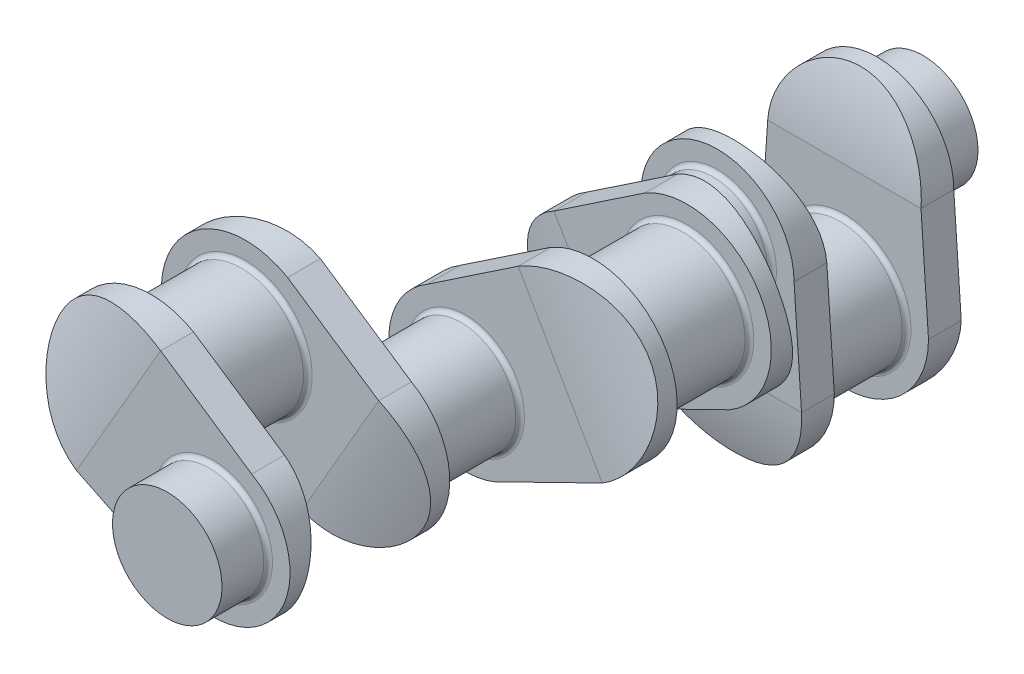
from build123d import *
from build123d.topology import SkipClean

# Parameters (mm, degrees)
SKETCH2_R             = 36.1
BOSS_EXTRUDE1_DEPTH   = 27.31
BOSS_EXTRUDE2_DEPTH   = 19
SKETCH4_R             = 31.75
BOSS_EXTRUDE3_DEPTH   = 26.76
CUT_EXTRUDE1_DEPTH    = 140.190040592
CUT_EXTRUDE7_DEPTH    = 140.190040627
FILLET6_R             = 2.54
FILLET6_OF_MIRROR1_R  = 2.54
LPATTERN13_COUNT      = 3
LPATTERN13_PITCH      = 146.14
BODY_MOVE_COPY1_ANGLE = 120
BODY_MOVE_COPY2_ANGLE = 120


with BuildPart() as part:
    # Sketch2 → Boss-Extrude1 (new body)
    with BuildSketch(Plane.XY):
        Circle(SKETCH2_R)
    boss_extrude1 = extrude(amount=BOSS_EXTRUDE1_DEPTH)

    # Sketch3 → Boss-Extrude2 (add)
    with BuildSketch(Plane.XY.offset(27.31)):
        with BuildLine():
            Line((-44.45, 63.5), (-48.8, 0))
            ThreePointArc((-48.8, 0), (0, -48.8), (48.8, 0))
            Line((48.8, 0), (44.45, 63.5))
            ThreePointArc((44.45, 63.5), (0, 107.95), (-44.45, 63.5))
        make_face()
    boss_extrude2 = extrude(amount=BOSS_EXTRUDE2_DEPTH)

    # Sketch4 → Boss-Extrude3 (add)
    with BuildSketch(Plane.XY.offset(46.31)):
        with Locations((0, 63.5)):
            Circle(SKETCH4_R)
    boss_extrude3 = extrude(amount=BOSS_EXTRUDE3_DEPTH)

    # Sketch5 → Cut-Extrude1 (cut, symmetric)
    with BuildSketch(Plane(origin=(0, 0, 0), x_dir=(0, 0, -1), z_dir=(1, 0, 0))):
        with BuildLine():
            Line((-46.31, 0), (-66.044239669, 0))
            Line((-66.044239669, 0), (-66.044239669, -48.8))
            Line((-66.044239669, -48.8), (-36.81, -48.8))
            ThreePointArc((-36.81, -48.8), (-43.36429868, -24.751246669), (-46.31, 0))
        make_face()
    cut_extrude1 = extrude(amount=CUT_EXTRUDE1_DEPTH, both=True, mode=Mode.SUBTRACT)

    # Sketch6 → Cut-Extrude7 (cut, symmetric)
    with BuildSketch(Plane(origin=(0, 0, 0), x_dir=(0, 0, -1), z_dir=(1, 0, 0))):
        with BuildLine():
            Line((-36.81, 107.95), (-15.735050366, 107.95))
            Line((-15.735050366, 107.95), (-15.735050366, 63.5))
            Line((-15.735050366, 63.5), (-27.31, 63.5))
            ThreePointArc((-27.31, 63.5), (-30.558785648, 86.045844462), (-36.81, 107.95))
        make_face()
    cut_extrude7 = extrude(amount=CUT_EXTRUDE7_DEPTH, both=True, mode=Mode.SUBTRACT)

    # Fillet6
    fillet6_edges = [part.edges().sort_by_distance(p)[0] for p in [
        (-31.75, 63.5, 46.31),
        (-36.1, 0, 27.31),
    ]]
    fillet(fillet6_edges, radius=FILLET6_R)

    # Mirror1: Boss-Extrude1, Boss-Extrude2, Boss-Extrude3, Cut-Extrude1, Cut-Extrude7 across plane
    add(boss_extrude1.mirror(Plane.XY))
    add(boss_extrude2.mirror(Plane.XY))
    add(boss_extrude3.mirror(Plane.XY))
    add(cut_extrude1.mirror(Plane.XY), mode=Mode.SUBTRACT)
    add(cut_extrude7.mirror(Plane.XY), mode=Mode.SUBTRACT)

    # Fillet6 of Mirror1
    fillet6_of_mirror1_edges = [part.edges().sort_by_distance(p)[0] for p in [
        (-31.75, 63.5, -46.31),
        (-36.1, 0, -27.31),
    ]]
    fillet(fillet6_of_mirror1_edges, radius=FILLET6_OF_MIRROR1_R)


with BuildPart() as lpattern13_1:
    # LPattern13: pattern copy
    add(part.part.moved(Location(Vector(0, 0, 1) * (1 * LPATTERN13_PITCH))))


with BuildPart() as lpattern13_2:
    # LPattern13: pattern copy
    add(part.part.moved(Location(Vector(0, 0, 1) * (2 * LPATTERN13_PITCH))))


with BuildPart() as lpattern13_1_1:
    # Body-Move/Copy1: moved
    add(lpattern13_1.part.rotate(Axis((0, 63.5, 0), (0, 0, 1)), BODY_MOVE_COPY1_ANGLE))


with BuildPart() as lpattern13_2_1:
    # Body-Move/Copy2: moved
    add(lpattern13_2.part.rotate(Axis((0, 63.5, 0), (0, 0, -1)), BODY_MOVE_COPY2_ANGLE))

    # Combine1: union LPattern13_1, part
    add(lpattern13_1_1.part)
    add(part.part)


solid = lpattern13_2_1.part
